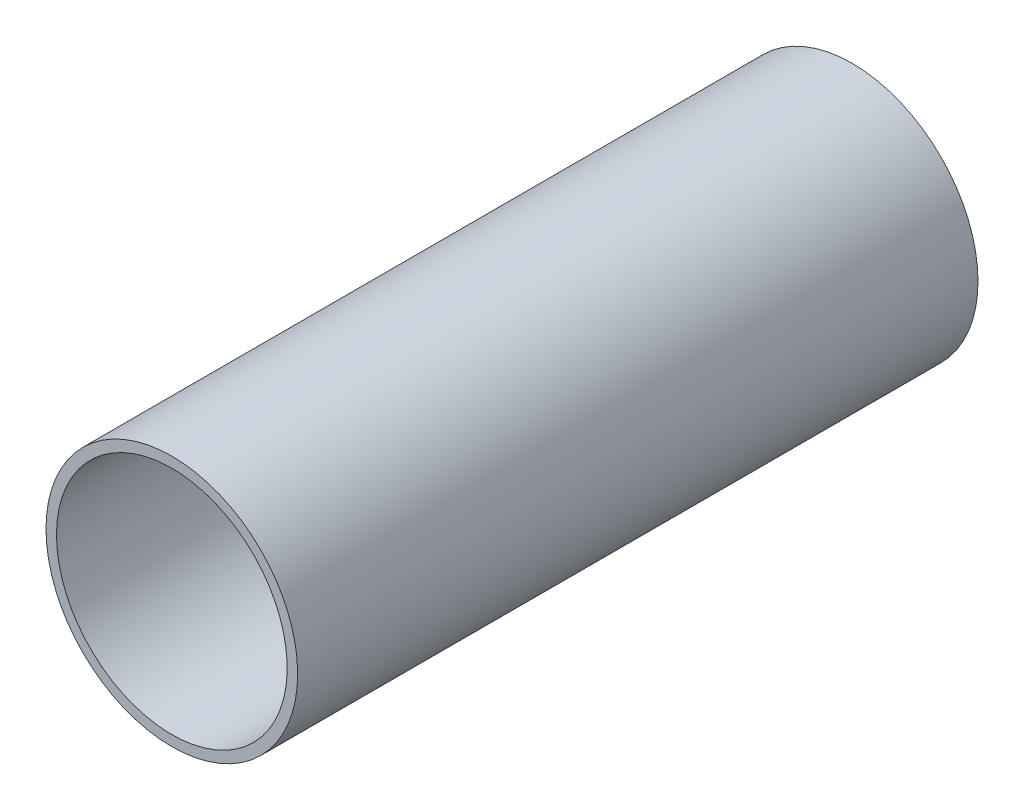
from build123d import *

# Parameters (mm, degrees)
SKETCH1_R           = 69.85
BOSS_EXTRUDE4_DEPTH = 412
SKETCH3_R           = 76.2
BOSS_EXTRUDE5_DEPTH = 412
SKETCH4_R           = 69.85
CUT_EXTRUDE2_DEPTH  = 412


with BuildPart() as part:
    # Sketch1 → Boss-Extrude4 (new body)
    with BuildSketch(Plane.XY):
        Circle(SKETCH1_R)
    extrude(amount=BOSS_EXTRUDE4_DEPTH)

    # Sketch3 → Boss-Extrude5 (add)
    with BuildSketch(Plane.XY.offset(412)):
        Circle(SKETCH3_R)
    extrude(amount=-BOSS_EXTRUDE5_DEPTH)

    # Sketch4 → Cut-Extrude2 (cut)
    with BuildSketch(Plane(origin=(0, 0, 0), x_dir=(-1, 0, 0), z_dir=(0, 0, -1))):
        Circle(SKETCH4_R)
    extrude(amount=-CUT_EXTRUDE2_DEPTH, mode=Mode.SUBTRACT)


solid = part.part
